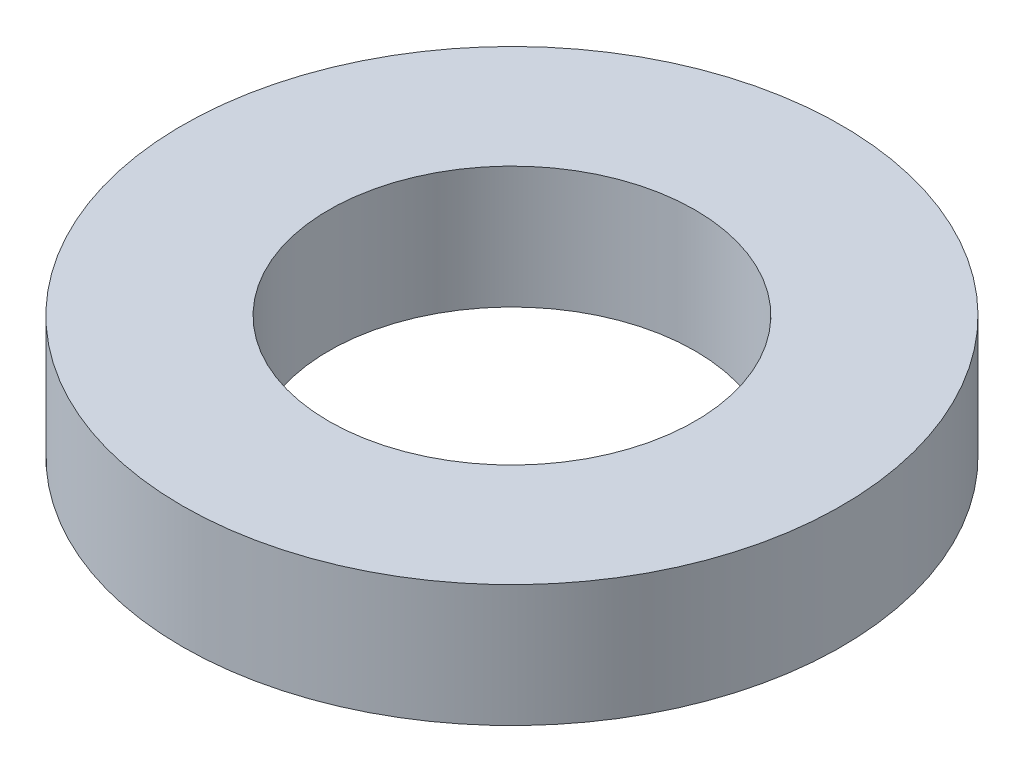
from build123d import *

# Parameters (mm, degrees)
SKETCH1_R           = 13.5
SKETCH1_R_2         = 7.5
BOSS_EXTRUDE1_DEPTH = 5


with BuildPart() as part:
    # Sketch1 → Boss-Extrude1 (new body)
    with BuildSketch(Plane(origin=(0, 0, 0), x_dir=(1, 0, 0), z_dir=(0, 1, 0))):
        with Locations(Location((0, 0, 0), (0, 0, 270))):
            Circle(SKETCH1_R)
        with Locations(Location((0, 0, 0), (0, 0, 270))):
            Circle(SKETCH1_R_2, mode=Mode.SUBTRACT)
    extrude(amount=BOSS_EXTRUDE1_DEPTH)


solid = part.part
